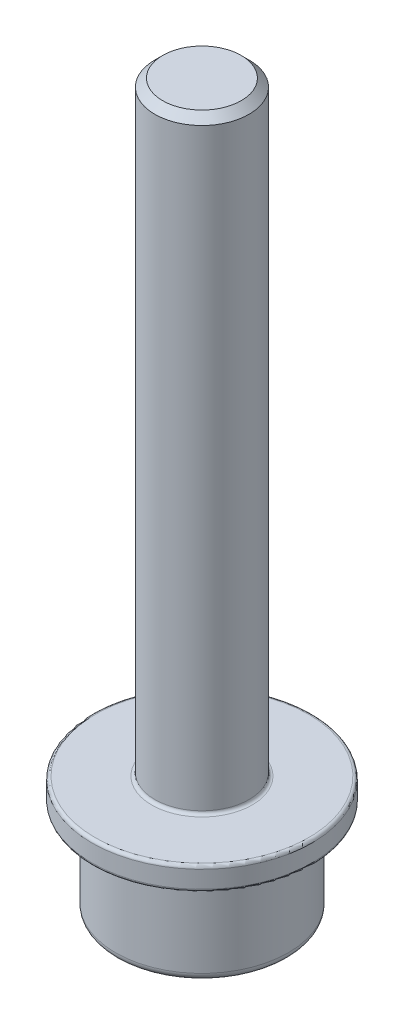
from build123d import *

# Parameters (mm, degrees)
SKETCH1_R           = 2.75
BOSS_EXTRUDE1_DEPTH = 3
SKETCH2_R           = 1.5
BOSS_EXTRUDE2_DEPTH = 20
CUT_EXTRUDE1_DEPTH  = 1.5
CHAMFER1_SIZE       = 0.25
FILLET1_R           = 0.25
CHAMFER2_SIZE       = 0.25
FILLET2_R           = 0.1
SKETCH4_R           = 3.5
SKETCH4_R_2         = 1.5
BOSS_EXTRUDE3_DEPTH = 0.75
FILLET3_R           = 0.1


with BuildPart() as part:
    # Sketch1 → Boss-Extrude1 (new body)
    with BuildSketch(Plane(origin=(0, 0, 0), x_dir=(1, 0, 0), z_dir=(0, 1, 0))):
        with Locations(Location((0, 0, 0), (0, 0, 270))):
            Circle(SKETCH1_R)
    extrude(amount=BOSS_EXTRUDE1_DEPTH)

    # Sketch2 → Boss-Extrude2 (add)
    with BuildSketch(Plane(origin=(0, 3, 0), x_dir=(1, 0, 0), z_dir=(0, 1, 0))):
        with Locations(Location((0, 0, 0), (0, 0, 270))):
            Circle(SKETCH2_R)
    extrude(amount=BOSS_EXTRUDE2_DEPTH)

    # Sketch3 → Cut-Extrude1 (cut)
    with BuildSketch(Plane.XZ):
        Polygon((0.934168857, 0.974591477), (-0.376936549, 1.2963097), (-1.311105406, 0.321718223), (-0.934168857, -0.974591477), (0.376936549, -1.2963097), (1.311105406, -0.321718223), align=None)
    extrude(amount=-CUT_EXTRUDE1_DEPTH, mode=Mode.SUBTRACT)

    # Chamfer1
    chamfer1_edges = [part.edges().sort_by_distance(p)[0] for p in [
        (1.122637131, 0, 0.326436627),
        (0.278616154, 0, 1.135450588),
        (-0.844020977, 0, 0.809013962),
        (-1.122637131, 0, -0.326436627),
        (-0.278616154, 0, -1.135450588),
        (0.844020977, 0, -0.809013962),
    ]]
    chamfer(chamfer1_edges, length=CHAMFER1_SIZE)

    # Fillet1
    fillet1_edges = [part.edges().sort_by_distance(p)[0] for p in [
        (0, 0, -2.75),
    ]]
    fillet(fillet1_edges, radius=FILLET1_R)

    # Chamfer2
    chamfer2_edges = [part.edges().sort_by_distance(p)[0] for p in [
        (0, 23, -1.5),
    ]]
    chamfer(chamfer2_edges, length=CHAMFER2_SIZE)

    # Fillet2
    fillet2_edges = [part.edges().sort_by_distance(p)[0] for p in [
        (0, 3, -2.75),
    ]]
    fillet(fillet2_edges, radius=FILLET2_R)

    # Sketch4 → Boss-Extrude3 (add)
    with BuildSketch(Plane(origin=(0, 3, 0), x_dir=(1, 0, 0), z_dir=(0, 1, 0))):
        with Locations(Location((0, 0, 0), (0, 0, 270))):
            Circle(SKETCH4_R)
        with Locations(Location((0, 0, 0), (0, 0, 270))):
            Circle(SKETCH4_R_2, mode=Mode.SUBTRACT)
    extrude(amount=BOSS_EXTRUDE3_DEPTH)

    # Fillet3
    fillet3_edges = [part.edges().sort_by_distance(p)[0] for p in [
        (0, 3.75, -3.5),
        (0, 3, -3.5),
        (0, 3.75, -1.5),
    ]]
    fillet(fillet3_edges, radius=FILLET3_R)


solid = part.part
